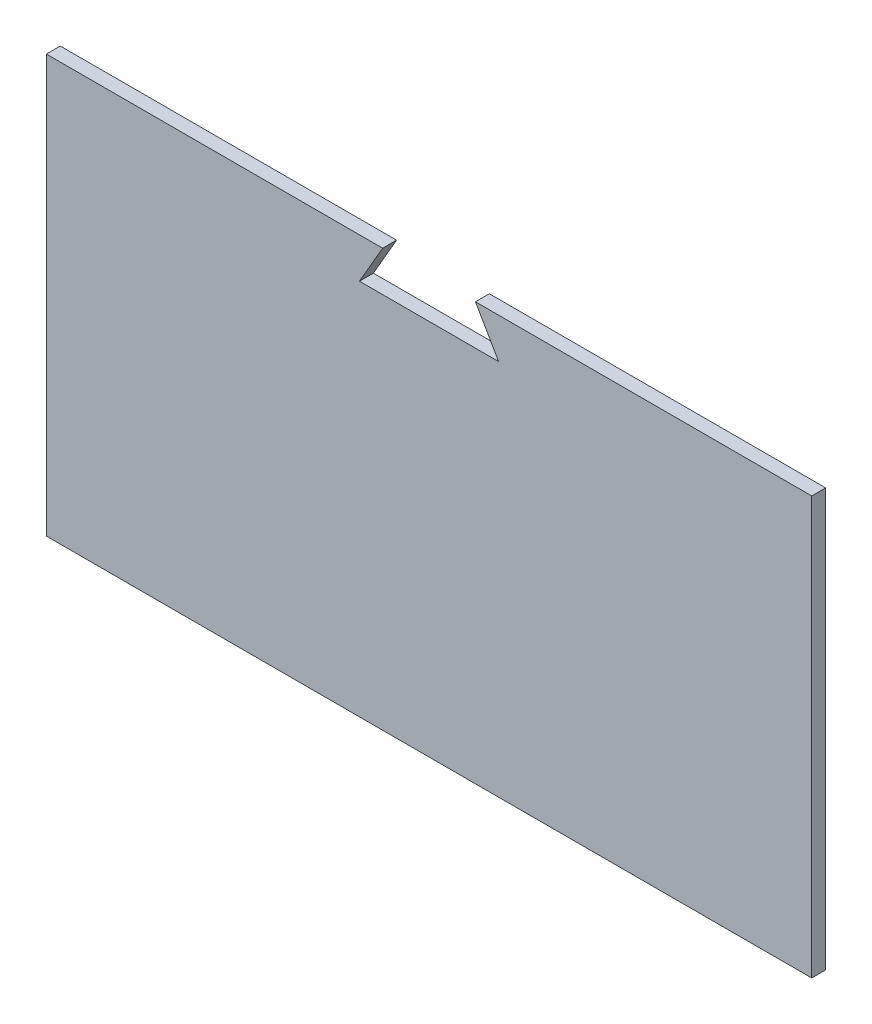
from build123d import *

# Parameters (mm, degrees)
SKETCH1_W           = 55
SKETCH1_H           = 30
BOSS_EXTRUDE1_DEPTH = 1
CUT_EXTRUDE1_DEPTH  = 33.611347718


with BuildPart() as part:
    # Sketch1 → Boss-Extrude1 (new body)
    with BuildSketch(Plane.XY):
        with Locations((0, 2.5)):
            Rectangle(SKETCH1_W, SKETCH1_H)
    extrude(amount=BOSS_EXTRUDE1_DEPTH)

    # Sketch2 → Cut-Extrude1 (cut, through all)
    with BuildSketch(Plane.XY.offset(1)):
        Polygon((0, 23.273502692), (-5, 14.613248654), (5, 14.613248654), align=None)
    extrude(amount=-CUT_EXTRUDE1_DEPTH, mode=Mode.SUBTRACT)


solid = part.part
